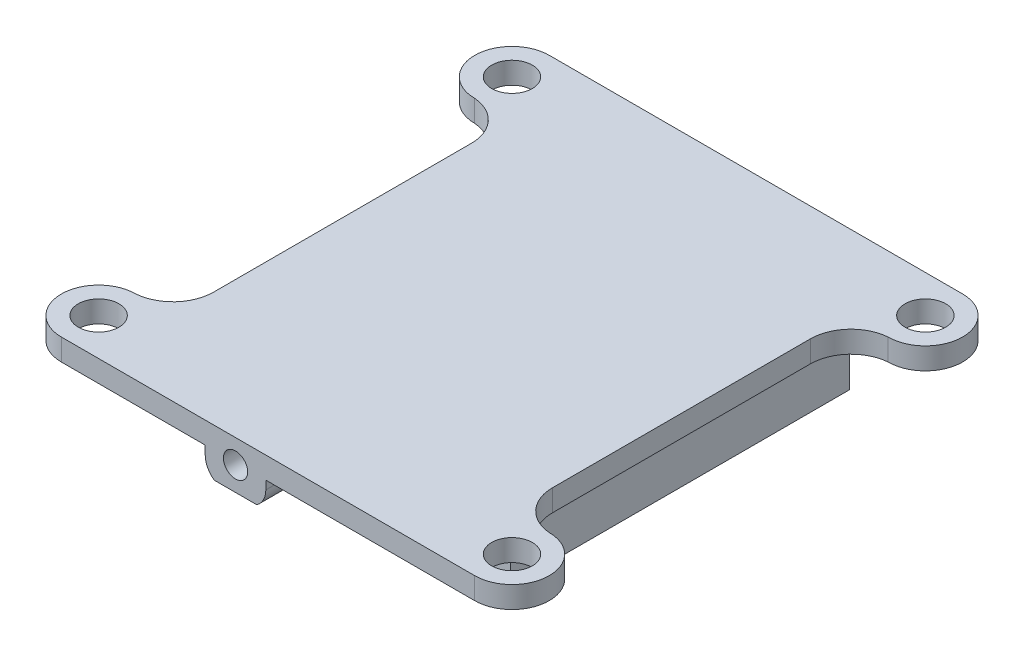
from build123d import *

# Parameters (mm, degrees)
SKETCH1_R           = 1.5
BOSS_EXTRUDE1_DEPTH = 1.6
SKETCH1_3_W         = 24.8
SKETCH1_3_H         = 25
BOSS_EXTRUDE2_DEPTH = 3.2
SKETCH2_R           = 0.895817692
BOSS_EXTRUDE3_DEPTH = 5.5
CUT_EXTRUDE1_DEPTH  = 5.5


with BuildPart() as part:
    # Sketch1 → Boss-Extrude1 (new body)
    with BuildSketch(Plane(origin=(0, 0, 0), x_dir=(1, 0, 0), z_dir=(0, 1, 0))):
        with BuildLine():
            Line((-12.5, 9.510434814), (-12.5, -9.510434814))
            ThreePointArc((-12.5, -9.510434814), (-13.292059783, -11.541444415), (-15.25, -12.5))
            ThreePointArc((-15.25, -12.5), (-18, -15.25), (-15.25, -18))
            Line((-15.25, -18), (15.25, -18))
            ThreePointArc((15.25, -18), (18, -15.25), (15.25, -12.5))
            ThreePointArc((15.25, -12.5), (13.292059783, -11.541444415), (12.5, -9.510434814))
            Line((12.5, -9.510434814), (12.5, 9.510434814))
            ThreePointArc((12.5, 9.510434814), (13.292059783, 11.541444415), (15.25, 12.5))
            ThreePointArc((15.25, 12.5), (18, 15.25), (15.25, 18))
            Line((15.25, 18), (-15.25, 18))
            ThreePointArc((-15.25, 18), (-18, 15.25), (-15.25, 12.5))
            ThreePointArc((-15.25, 12.5), (-13.292059783, 11.541444415), (-12.5, 9.510434814))
        make_face()
        with Locations(Location((-15.25, -15.25, 0), (0, 0, 270))):
            Circle(SKETCH1_R, mode=Mode.SUBTRACT)
        with Locations(Location((-15.25, 15.25, 0), (0, 0, 270))):
            Circle(SKETCH1_R, mode=Mode.SUBTRACT)
        with Locations(Location((15.25, -15.25, 0), (0, 0, 270))):
            Circle(SKETCH1_R, mode=Mode.SUBTRACT)
        with Locations(Location((15.25, 15.25, 0), (0, 0, 270))):
            Circle(SKETCH1_R, mode=Mode.SUBTRACT)
    extrude(amount=BOSS_EXTRUDE1_DEPTH)

    # Sketch1<3> → Boss-Extrude2 (add)
    with BuildSketch(Plane(origin=(0, 0, 0), x_dir=(1, 0, 0), z_dir=(0, 1, 0))):
        Rectangle(SKETCH1_3_W, SKETCH1_3_H)
    extrude(amount=-BOSS_EXTRUDE2_DEPTH)

    # Sketch2 → Boss-Extrude3 (add)
    with BuildSketch(Plane.XY.offset(18)):
        with BuildLine():
            Line((-4.635, 0), (-4.1, 0))
            Line((-4.1, 0), (-4.1, 1.6))
            Line((-4.1, 1.6), (-0.7, 1.6))
            Line((-0.7, 1.6), (-0.7, 0))
            Line((-0.7, 0), (-0.165, 0))
            Line((-0.165, 0), (-0.165, -0.630150614))
            ThreePointArc((-0.165, -0.630150614), (-0.342571379, -1.352412026), (-0.834799774, -1.91))
            Line((-0.834799774, -1.91), (-3.965200226, -1.91))
            ThreePointArc((-3.965200226, -1.91), (-4.457428621, -1.352412026), (-4.635, -0.630150614))
            Line((-4.635, -0.630150614), (-4.635, 0))
        make_face()
        with Locations((-2.4, -0.15)):
            Circle(SKETCH2_R, mode=Mode.SUBTRACT)
    extrude(amount=-BOSS_EXTRUDE3_DEPTH)

    # Sketch2<2> → Cut-Extrude1 (cut)
    with BuildSketch(Plane.XY.offset(18)):
        with BuildLine():
            Line((-1.51682995, 0), (-3.28317005, 0))
            ThreePointArc((-3.28317005, 0), (-2.475266133, -1.042650182), (-1.504182308, -0.15))
            ThreePointArc((-1.504182308, -0.15), (-1.507349818, -0.074733867), (-1.51682995, 0))
        make_face()
        with BuildLine():
            ThreePointArc((-1.51682995, 0), (-2.4, 0.745817692), (-3.28317005, 0))
            Line((-3.28317005, 0), (-1.51682995, 0))
        make_face()
    extrude(amount=-CUT_EXTRUDE1_DEPTH, mode=Mode.SUBTRACT)


solid = part.part
